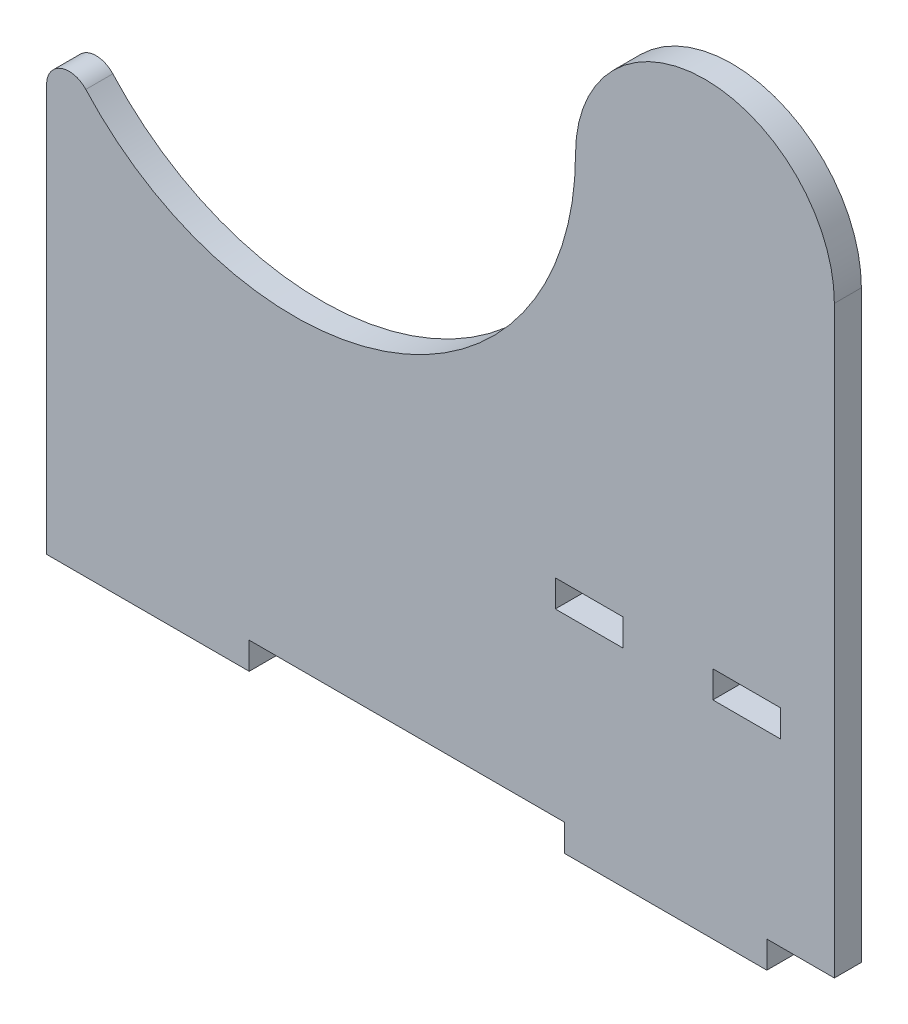
from build123d import *

# Parameters (mm, degrees)
BOSS_EXTRUDE1_DEPTH = 6
SKETCH2_W           = 15
SKETCH2_H           = 6
CUT_EXTRUDE1_DEPTH  = 10
FILLET1_R           = 5


with BuildPart() as part:
    # Sketch1 → Boss-Extrude1 (new body)
    with BuildSketch(Plane.XY):
        with BuildLine():
            Line((105.001506242, -129.791901429), (120.001506242, -129.791901429))
            Line((120.001506242, -129.791901429), (120.001506242, 0))
            ThreePointArc((120.001506242, 0), (91.250753121, 28.750753121), (62.5, 0))
            ThreePointArc((62.5, 0), (15.310848117, -60.595609824), (-54.998493758, -29.688645714))
            Line((-54.998493758, -29.688645714), (-54.998493758, -129.791901429))
            Line((-54.998493758, -129.791901429), (-54.998493758, -135.791901429))
            Line((-54.998493758, -135.791901429), (-9.998493758, -135.791901429))
            Line((-9.998493758, -135.791901429), (-9.998493758, -129.791901429))
            Line((-9.998493758, -129.791901429), (60.001506242, -129.791901429))
            Line((60.001506242, -129.791901429), (60.001506242, -135.791901429))
            Line((60.001506242, -135.791901429), (105.001506242, -135.791901429))
            Line((105.001506242, -135.791901429), (105.001506242, -129.791901429))
        make_face()
    extrude(amount=BOSS_EXTRUDE1_DEPTH)

    # Sketch2 → Cut-Extrude1 (cut)
    with BuildSketch(Plane.XY.offset(6)):
        with Locations((65.501506242, -86.791901429)):
            Rectangle(SKETCH2_W, SKETCH2_H)
        with Locations((100.501506242, -86.791901429)):
            Rectangle(SKETCH2_W, SKETCH2_H)
    extrude(amount=-CUT_EXTRUDE1_DEPTH, mode=Mode.SUBTRACT)

    # Fillet1
    fillet1_edges = [part.edges().sort_by_distance(p)[0] for p in [
        (-54.998493758, -29.688645714, 3),
    ]]
    fillet(fillet1_edges, radius=FILLET1_R)


solid = part.part
